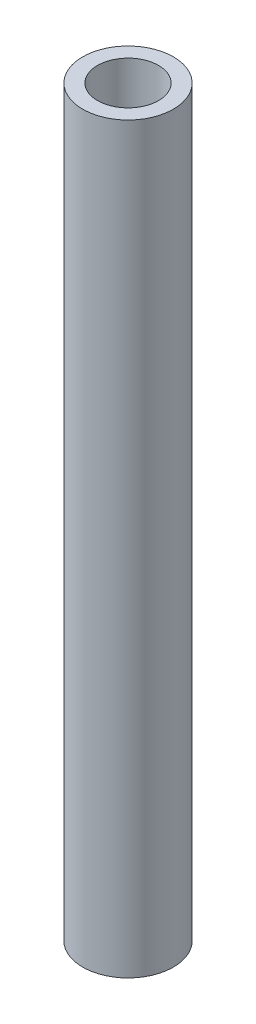
from build123d import *

# Parameters (mm, degrees)
SKETCH1_R    = 0.7366
SKETCH1_R_2  = 0.4953
NEEDLE_DEPTH = 12.065


with BuildPart() as part:
    # Sketch1 → Needle (new body)
    with BuildSketch(Plane(origin=(0, 0, 0), x_dir=(1, 0, 0), z_dir=(0, 1, 0))):
        Circle(SKETCH1_R)
        Circle(SKETCH1_R_2, mode=Mode.SUBTRACT)
    extrude(amount=NEEDLE_DEPTH)


solid = part.part
